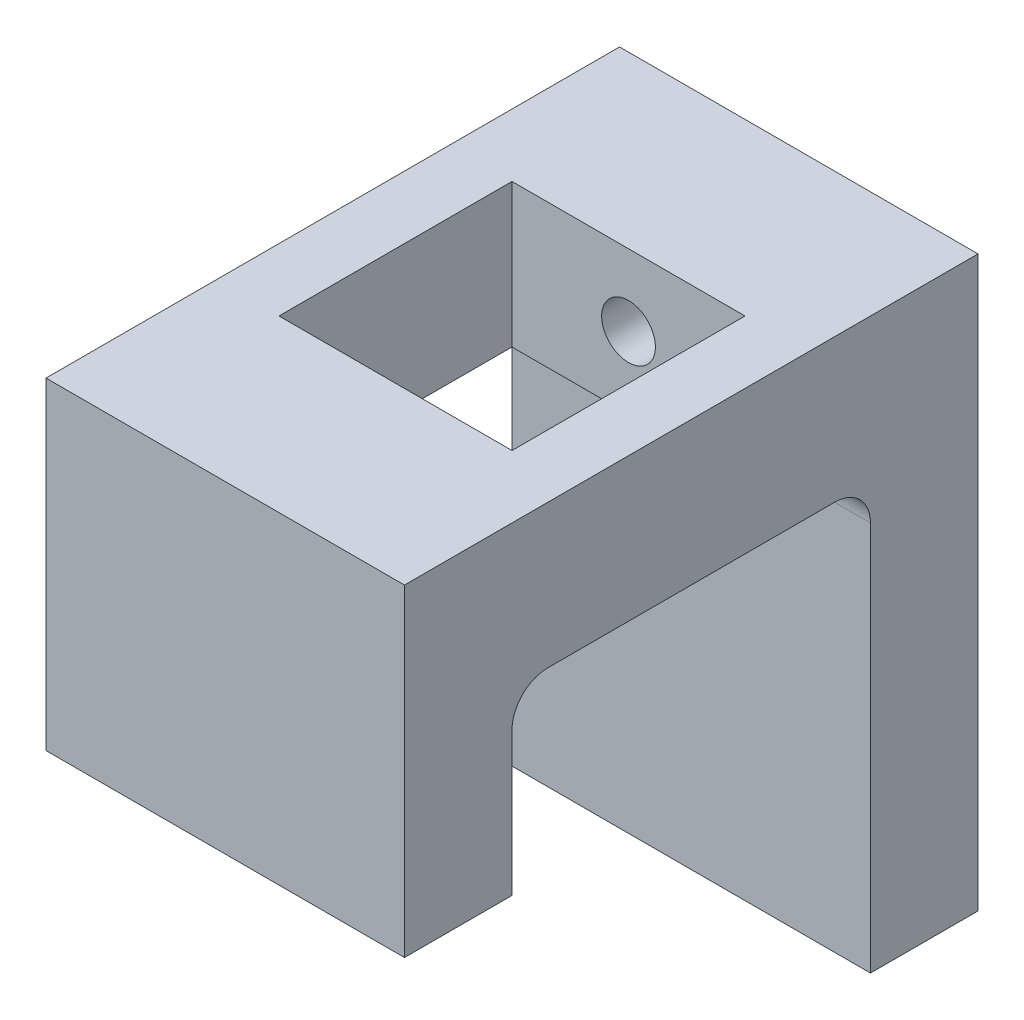
from build123d import *

# Parameters (mm, degrees)
SKETCH1_W           = 20
SKETCH1_H           = 6
BOSS_EXTRUDE1_DEPTH = 75
SKETCH2_W           = 20
SKETCH2_H           = 8
BOSS_EXTRUDE2_DEPTH = 26
SKETCH3_W           = 20
SKETCH3_H           = 6
BOSS_EXTRUDE3_DEPTH = 10
SKETCH6_W           = 13
SKETCH6_H           = 13
CUT_EXTRUDE1_DEPTH  = 79.014421744
SKETCH8_R           = 1.5
CUT_EXTRUDE3_DEPTH  = 5
CUT_EXTRUDE4_START  = -5
SKETCH9_R           = 1.5
CUT_EXTRUDE4_DEPTH  = 5
FILLET1_R           = 2
SKETCH10_W          = 6
SKETCH10_H          = 44.050587659
CUT_EXTRUDE5_DEPTH  = 20


with BuildPart() as part:
    # Sketch1 → Boss-Extrude1 (new body)
    with BuildSketch(Plane(origin=(0, 0, 0), x_dir=(1, 0, 0), z_dir=(0, 1, 0))):
        with Locations((-17.5, 0)):
            Rectangle(SKETCH1_W, SKETCH1_H)
    extrude(amount=BOSS_EXTRUDE1_DEPTH)

    # Sketch2 → Boss-Extrude2 (add)
    with BuildSketch(Plane.XY.offset(3)):
        with Locations((-17.5, 71)):
            Rectangle(SKETCH2_W, SKETCH2_H)
    extrude(amount=BOSS_EXTRUDE2_DEPTH)

    # Sketch3 → Boss-Extrude3 (add)
    with BuildSketch(Plane.XZ.offset(-67)):
        with Locations((-17.5, 26)):
            Rectangle(SKETCH3_W, SKETCH3_H)
    extrude(amount=BOSS_EXTRUDE3_DEPTH)

    # Sketch6 → Cut-Extrude1 (cut, through all)
    with BuildSketch(Plane.XZ.offset(-67)):
        with Locations((-17.5, 13)):
            Rectangle(SKETCH6_W, SKETCH6_H)
    extrude(amount=-CUT_EXTRUDE1_DEPTH, mode=Mode.SUBTRACT)

    # Sketch8 → Cut-Extrude3 (cut)
    with BuildSketch(Plane.XY.offset(6.5)):
        with Locations((-17.5, 71)):
            Circle(SKETCH8_R)
    extrude(amount=-CUT_EXTRUDE3_DEPTH, mode=Mode.SUBTRACT)

    # Sketch9 → Cut-Extrude4 (cut)
    with BuildSketch(Plane(origin=(0, 0, 19.5), x_dir=(-1, 0, 0), z_dir=(0, 0, -1)).offset(CUT_EXTRUDE4_START)):
        with Locations(Location((17.5, 71, 0), (0, 0, 180))):
            Circle(SKETCH9_R)
    extrude(amount=CUT_EXTRUDE4_DEPTH, mode=Mode.SUBTRACT)

    # Fillet1
    fillet1_edges = [part.edges().sort_by_distance(p)[0] for p in [
        (-17.5, 67, 3),
        (-17.5, 67, 23),
    ]]
    fillet(fillet1_edges, radius=FILLET1_R)

    # Sketch10 → Cut-Extrude5 (cut)
    with BuildSketch(Plane(origin=(-7.5, 0, 0), x_dir=(0, 0, -1), z_dir=(1, 0, 0))):
        with Locations((0, 21.22470617)):
            Rectangle(SKETCH10_W, SKETCH10_H)
    extrude(amount=-CUT_EXTRUDE5_DEPTH, mode=Mode.SUBTRACT)


solid = part.part
